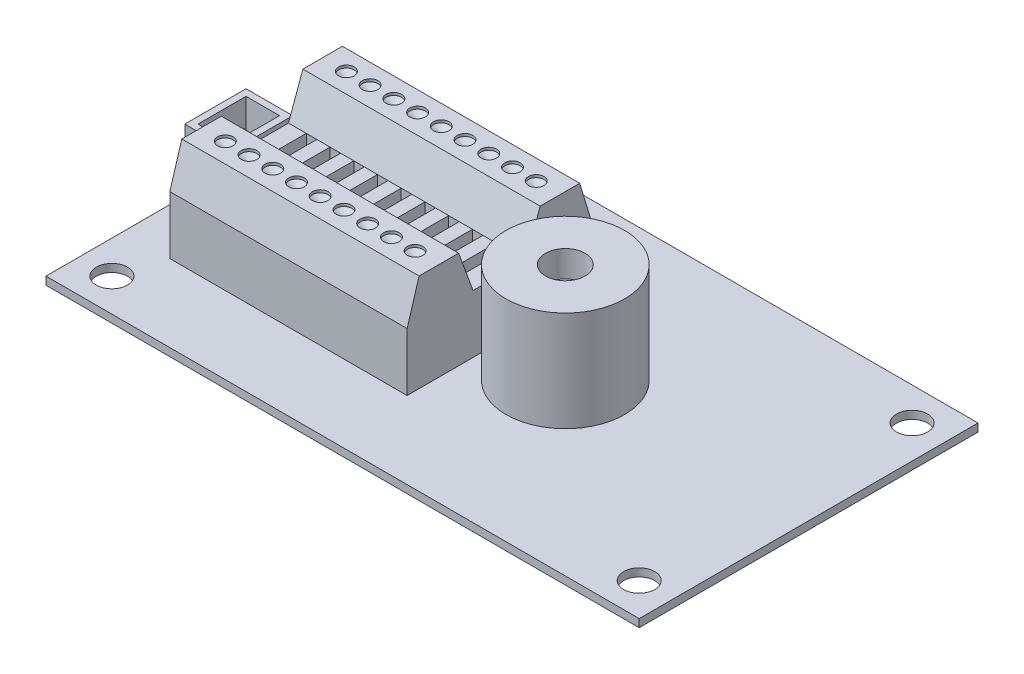
from build123d import *

# Parameters (mm, degrees)
SKETCH1_W                      = 57.15
SKETCH1_H                      = 32.639
BOSS_EXTRUDE1_DEPTH            = 0.762
F_3_0MM_DOWEL_HOLE1_D          = 3
SKETCH5_W                      = 4.5
SKETCH5_H                      = 5.9
BOSS_EXTRUDE2_DEPTH            = 6
SKETCH6_W                      = 3.23
SKETCH6_H                      = 4.63
CUT_EXTRUDE1_DEPTH             = 5.08
SKETCH7_R                      = 0.25
BOSS_EXTRUDE3_DEPTH            = 3.4
BOSS_EXTRUDE4_DEPTH            = 22.86
F_1_5MM_DOWEL_HOLE1_AT_2_COUNT = 2
F_1_5MM_DOWEL_HOLE1_AT_2_PITCH = 2.286
F_1_5MM_DOWEL_HOLE1_AT_3_COUNT = 2
F_1_5MM_DOWEL_HOLE1_AT_3_PITCH = 4.572
F_1_5MM_DOWEL_HOLE1_AT_4_COUNT = 2
F_1_5MM_DOWEL_HOLE1_AT_4_PITCH = 6.858
F_1_5MM_DOWEL_HOLE1_AT_5_COUNT = 2
F_1_5MM_DOWEL_HOLE1_AT_5_PITCH = 9.144
F_1_5MM_DOWEL_HOLE1_AT_6_COUNT = 2
F_1_5MM_DOWEL_HOLE1_AT_6_PITCH = 11.43
F_1_5MM_DOWEL_HOLE1_AT_7_COUNT = 2
F_1_5MM_DOWEL_HOLE1_AT_7_PITCH = 13.716
F_1_5MM_DOWEL_HOLE1_AT_8_COUNT = 2
F_1_5MM_DOWEL_HOLE1_AT_8_PITCH = 16.002
F_1_5MM_DOWEL_HOLE1_AT_9_COUNT = 2
F_1_5MM_DOWEL_HOLE1_AT_9_PITCH = 18.288
SKETCH13_W                     = 1.016
SKETCH13_H                     = 2.54
CUT_EXTRUDE2_DEPTH             = 1.27
LPATTERN1_COUNT                = 9
LPATTERN1_PITCH                = 2.286
MIRROR1_COPY_9_SKETCH_W        = 1.016
MIRROR1_COPY_9_SKETCH_H        = 2.54
MIRROR1_COPY_9_DEPTH           = 1.27
MIRROR1_COPY_10_SKETCH_W       = 1.016
MIRROR1_COPY_10_SKETCH_H       = 2.54
MIRROR1_COPY_10_DEPTH          = 1.27
MIRROR1_COPY_11_SKETCH_W       = 1.016
MIRROR1_COPY_11_SKETCH_H       = 2.54
MIRROR1_COPY_11_DEPTH          = 1.27
MIRROR1_COPY_12_SKETCH_W       = 1.016
MIRROR1_COPY_12_SKETCH_H       = 2.54
MIRROR1_COPY_12_DEPTH          = 1.27
MIRROR1_COPY_13_SKETCH_W       = 1.016
MIRROR1_COPY_13_SKETCH_H       = 2.54
MIRROR1_COPY_13_DEPTH          = 1.27
MIRROR1_COPY_14_SKETCH_W       = 1.016
MIRROR1_COPY_14_SKETCH_H       = 2.54
MIRROR1_COPY_14_DEPTH          = 1.27
MIRROR1_COPY_15_SKETCH_W       = 1.016
MIRROR1_COPY_15_SKETCH_H       = 2.54
MIRROR1_COPY_15_DEPTH          = 1.27
MIRROR1_COPY_16_SKETCH_W       = 1.016
MIRROR1_COPY_16_SKETCH_H       = 2.54
MIRROR1_COPY_16_DEPTH          = 1.27
SKETCH15_R                     = 5.715
BOSS_EXTRUDE5_DEPTH            = 9.652
SKETCH16_R                     = 1.905
CUT_EXTRUDE3_DEPTH             = 2.54


with BuildPart() as part:
    # Sketch1 → Boss-Extrude1 (new body)
    with BuildSketch(Plane(origin=(0, 0, 0), x_dir=(1, 0, 0), z_dir=(0, 1, 0))):
        Rectangle(SKETCH1_W, SKETCH1_H)
    extrude(amount=BOSS_EXTRUDE1_DEPTH)

    # Ø3.0mm Dowel Hole1 (through all)
    with Locations(Plane(origin=(0, 0.762, 0), x_dir=(1, 0, 0), z_dir=(0, 1, 0))):
        with Locations((-25.4, 13.1445), (-25.4, -13.1445), (25.4, -13.1445), (25.4, 13.1445)):
            Hole(F_3_0MM_DOWEL_HOLE1_D / 2)

    # Sketch5 → Boss-Extrude2 (add)
    with BuildSketch(Plane(origin=(0, 0.762, 0), x_dir=(1, 0, 0), z_dir=(0, 1, 0))):
        with Locations((-26.325, 0)):
            Rectangle(SKETCH5_W, SKETCH5_H)
    extrude(amount=BOSS_EXTRUDE2_DEPTH)

    # Sketch6 → Cut-Extrude1 (cut)
    with BuildSketch(Plane(origin=(0, 6.762, 0), x_dir=(1, 0, 0), z_dir=(0, 1, 0))):
        with Locations((-26.325, 0)):
            Rectangle(SKETCH6_W, SKETCH6_H)
    extrude(amount=-CUT_EXTRUDE1_DEPTH, mode=Mode.SUBTRACT)

    # Sketch7 → Boss-Extrude3 (add)
    with BuildSketch(Plane(origin=(0, 1.682, 0), x_dir=(1, 0, 0), z_dir=(0, 1, 0))):
        with Locations(Location((-26.875, 1, 0), (0, 0, 270))):
            Circle(SKETCH7_R)
        with Locations(Location((-26.875, -1, 0), (0, 0, 270))):
            Circle(SKETCH7_R)
    extrude(amount=BOSS_EXTRUDE3_DEPTH)

    # Sketch9 → Boss-Extrude4 (add)
    with BuildSketch(Plane(origin=(-24.075, 0, 0), x_dir=(0, 0, -1), z_dir=(1, 0, 0))):
        Polygon((0, 0), (0, 6.35), (2.54, 6.35), (3.926726593, 10.16), (7.736726593, 10.16), (8.89, 6.35), (8.89, 0), align=None)
    boss_extrude4 = extrude(amount=BOSS_EXTRUDE4_DEPTH)

    # Sketch11 → Ø1.5mm Dowel Hole1 (revolve, cut)
    with BuildSketch(Plane(origin=(-21.789, 10.16, -5.831726593), x_dir=(0, 0, 1), z_dir=(1, 0, 0))):
        Polygon((0, 0), (0, 0.704645464), (0.75, 0.254), (0.75, 0), align=None)
    f_1_5mm_dowel_hole1 = revolve(axis=Axis((-21.789, 16.51, -5.831726593), (0, -1, 0)), mode=Mode.SUBTRACT)

    # Ø1.5mm Dowel Hole1 at 2: Ø1.5mm Dowel Hole1 ×2
    with Locations(*[(i * F_1_5MM_DOWEL_HOLE1_AT_2_PITCH, 0, 0) for i in range(1, F_1_5MM_DOWEL_HOLE1_AT_2_COUNT)]):
        add(f_1_5mm_dowel_hole1, mode=Mode.SUBTRACT)

    # Ø1.5mm Dowel Hole1 at 3: Ø1.5mm Dowel Hole1 ×2
    with Locations(*[(i * F_1_5MM_DOWEL_HOLE1_AT_3_PITCH, 0, 0) for i in range(1, F_1_5MM_DOWEL_HOLE1_AT_3_COUNT)]):
        add(f_1_5mm_dowel_hole1, mode=Mode.SUBTRACT)

    # Ø1.5mm Dowel Hole1 at 4: Ø1.5mm Dowel Hole1 ×2
    with Locations(*[(i * F_1_5MM_DOWEL_HOLE1_AT_4_PITCH, 0, 0) for i in range(1, F_1_5MM_DOWEL_HOLE1_AT_4_COUNT)]):
        add(f_1_5mm_dowel_hole1, mode=Mode.SUBTRACT)

    # Ø1.5mm Dowel Hole1 at 5: Ø1.5mm Dowel Hole1 ×2
    with Locations(*[(i * F_1_5MM_DOWEL_HOLE1_AT_5_PITCH, 0, 0) for i in range(1, F_1_5MM_DOWEL_HOLE1_AT_5_COUNT)]):
        add(f_1_5mm_dowel_hole1, mode=Mode.SUBTRACT)

    # Ø1.5mm Dowel Hole1 at 6: Ø1.5mm Dowel Hole1 ×2
    with Locations(*[(i * F_1_5MM_DOWEL_HOLE1_AT_6_PITCH, 0, 0) for i in range(1, F_1_5MM_DOWEL_HOLE1_AT_6_COUNT)]):
        add(f_1_5mm_dowel_hole1, mode=Mode.SUBTRACT)

    # Ø1.5mm Dowel Hole1 at 7: Ø1.5mm Dowel Hole1 ×2
    with Locations(*[(i * F_1_5MM_DOWEL_HOLE1_AT_7_PITCH, 0, 0) for i in range(1, F_1_5MM_DOWEL_HOLE1_AT_7_COUNT)]):
        add(f_1_5mm_dowel_hole1, mode=Mode.SUBTRACT)

    # Ø1.5mm Dowel Hole1 at 8: Ø1.5mm Dowel Hole1 ×2
    with Locations(*[(i * F_1_5MM_DOWEL_HOLE1_AT_8_PITCH, 0, 0) for i in range(1, F_1_5MM_DOWEL_HOLE1_AT_8_COUNT)]):
        add(f_1_5mm_dowel_hole1, mode=Mode.SUBTRACT)

    # Ø1.5mm Dowel Hole1 at 9: Ø1.5mm Dowel Hole1 ×2
    with Locations(*[(i * F_1_5MM_DOWEL_HOLE1_AT_9_PITCH, 0, 0) for i in range(1, F_1_5MM_DOWEL_HOLE1_AT_9_COUNT)]):
        add(f_1_5mm_dowel_hole1, mode=Mode.SUBTRACT)

    # Sketch13 → Cut-Extrude2 (cut)
    with BuildSketch(Plane(origin=(0, 6.35, 0), x_dir=(1, 0, 0), z_dir=(0, 1, 0))):
        with Locations((-21.847835496, 1.27)):
            Rectangle(SKETCH13_W, SKETCH13_H)
    cut_extrude2 = extrude(amount=-CUT_EXTRUDE2_DEPTH, mode=Mode.SUBTRACT)

    # LPattern1: Cut-Extrude2 ×9
    with Locations(*[(i * LPATTERN1_PITCH, 0, 0) for i in range(1, LPATTERN1_COUNT)]):
        add(cut_extrude2, mode=Mode.SUBTRACT)

    # Mirror1: Boss-Extrude4, Ø1.5mm Dowel Hole1, Cut-Extrude2 across plane
    add(boss_extrude4.mirror(Plane.XY))
    add(f_1_5mm_dowel_hole1.mirror(Plane.XY), mode=Mode.SUBTRACT)
    add(cut_extrude2.mirror(Plane.XY), mode=Mode.SUBTRACT)

    # Mirror1 copy 1 sketch → Mirror1 copy 1 (revolve, cut)
    with BuildSketch(Plane(origin=(-19.503, 10.16, 5.831726593), x_dir=(0, 0, -1), z_dir=(1, 0, 0))):
        Polygon((0, 0), (0, -0.704645464), (0.75, -0.254), (0.75, 0), align=None)
    revolve(axis=Axis((-19.503, 16.51, 5.831726593), (0, 1, 0)), mode=Mode.SUBTRACT)

    # Mirror1 copy 2 sketch → Mirror1 copy 2 (revolve, cut)
    with BuildSketch(Plane(origin=(-17.217, 10.16, 5.831726593), x_dir=(0, 0, -1), z_dir=(1, 0, 0))):
        Polygon((0, 0), (0, -0.704645464), (0.75, -0.254), (0.75, 0), align=None)
    revolve(axis=Axis((-17.217, 16.51, 5.831726593), (0, 1, 0)), mode=Mode.SUBTRACT)

    # Mirror1 copy 3 sketch → Mirror1 copy 3 (revolve, cut)
    with BuildSketch(Plane(origin=(-14.931, 10.16, 5.831726593), x_dir=(0, 0, -1), z_dir=(1, 0, 0))):
        Polygon((0, 0), (0, -0.704645464), (0.75, -0.254), (0.75, 0), align=None)
    revolve(axis=Axis((-14.931, 16.51, 5.831726593), (0, 1, 0)), mode=Mode.SUBTRACT)

    # Mirror1 copy 4 sketch → Mirror1 copy 4 (revolve, cut)
    with BuildSketch(Plane(origin=(-12.645, 10.16, 5.831726593), x_dir=(0, 0, -1), z_dir=(1, 0, 0))):
        Polygon((0, 0), (0, -0.704645464), (0.75, -0.254), (0.75, 0), align=None)
    revolve(axis=Axis((-12.645, 16.51, 5.831726593), (0, 1, 0)), mode=Mode.SUBTRACT)

    # Mirror1 copy 5 sketch → Mirror1 copy 5 (revolve, cut)
    with BuildSketch(Plane(origin=(-10.359, 10.16, 5.831726593), x_dir=(0, 0, -1), z_dir=(1, 0, 0))):
        Polygon((0, 0), (0, -0.704645464), (0.75, -0.254), (0.75, 0), align=None)
    revolve(axis=Axis((-10.359, 16.51, 5.831726593), (0, 1, 0)), mode=Mode.SUBTRACT)

    # Mirror1 copy 6 sketch → Mirror1 copy 6 (revolve, cut)
    with BuildSketch(Plane(origin=(-8.073, 10.16, 5.831726593), x_dir=(0, 0, -1), z_dir=(1, 0, 0))):
        Polygon((0, 0), (0, -0.704645464), (0.75, -0.254), (0.75, 0), align=None)
    revolve(axis=Axis((-8.073, 16.51, 5.831726593), (0, 1, 0)), mode=Mode.SUBTRACT)

    # Mirror1 copy 7 sketch → Mirror1 copy 7 (revolve, cut)
    with BuildSketch(Plane(origin=(-5.787, 10.16, 5.831726593), x_dir=(0, 0, -1), z_dir=(1, 0, 0))):
        Polygon((0, 0), (0, -0.704645464), (0.75, -0.254), (0.75, 0), align=None)
    revolve(axis=Axis((-5.787, 16.51, 5.831726593), (0, 1, 0)), mode=Mode.SUBTRACT)

    # Mirror1 copy 8 sketch → Mirror1 copy 8 (revolve, cut)
    with BuildSketch(Plane(origin=(-3.501, 10.16, 5.831726593), x_dir=(0, 0, -1), z_dir=(1, 0, 0))):
        Polygon((0, 0), (0, -0.704645464), (0.75, -0.254), (0.75, 0), align=None)
    revolve(axis=Axis((-3.501, 16.51, 5.831726593), (0, 1, 0)), mode=Mode.SUBTRACT)

    # Mirror1 copy 9 sketch → Mirror1 copy 9 (cut)
    with BuildSketch(Plane(origin=(2.286, 6.35, 0), x_dir=(1, 0, 0), z_dir=(0, 1, 0))):
        with Locations((-21.847835496, -1.27)):
            Rectangle(MIRROR1_COPY_9_SKETCH_W, MIRROR1_COPY_9_SKETCH_H)
    extrude(amount=-MIRROR1_COPY_9_DEPTH, mode=Mode.SUBTRACT)

    # Mirror1 copy 10 sketch → Mirror1 copy 10 (cut)
    with BuildSketch(Plane(origin=(4.572, 6.35, 0), x_dir=(1, 0, 0), z_dir=(0, 1, 0))):
        with Locations((-21.847835496, -1.27)):
            Rectangle(MIRROR1_COPY_10_SKETCH_W, MIRROR1_COPY_10_SKETCH_H)
    extrude(amount=-MIRROR1_COPY_10_DEPTH, mode=Mode.SUBTRACT)

    # Mirror1 copy 11 sketch → Mirror1 copy 11 (cut)
    with BuildSketch(Plane(origin=(6.858, 6.35, 0), x_dir=(1, 0, 0), z_dir=(0, 1, 0))):
        with Locations((-21.847835496, -1.27)):
            Rectangle(MIRROR1_COPY_11_SKETCH_W, MIRROR1_COPY_11_SKETCH_H)
    extrude(amount=-MIRROR1_COPY_11_DEPTH, mode=Mode.SUBTRACT)

    # Mirror1 copy 12 sketch → Mirror1 copy 12 (cut)
    with BuildSketch(Plane(origin=(9.144, 6.35, 0), x_dir=(1, 0, 0), z_dir=(0, 1, 0))):
        with Locations((-21.847835496, -1.27)):
            Rectangle(MIRROR1_COPY_12_SKETCH_W, MIRROR1_COPY_12_SKETCH_H)
    extrude(amount=-MIRROR1_COPY_12_DEPTH, mode=Mode.SUBTRACT)

    # Mirror1 copy 13 sketch → Mirror1 copy 13 (cut)
    with BuildSketch(Plane(origin=(11.43, 6.35, 0), x_dir=(1, 0, 0), z_dir=(0, 1, 0))):
        with Locations((-21.847835496, -1.27)):
            Rectangle(MIRROR1_COPY_13_SKETCH_W, MIRROR1_COPY_13_SKETCH_H)
    extrude(amount=-MIRROR1_COPY_13_DEPTH, mode=Mode.SUBTRACT)

    # Mirror1 copy 14 sketch → Mirror1 copy 14 (cut)
    with BuildSketch(Plane(origin=(13.716, 6.35, 0), x_dir=(1, 0, 0), z_dir=(0, 1, 0))):
        with Locations((-21.847835496, -1.27)):
            Rectangle(MIRROR1_COPY_14_SKETCH_W, MIRROR1_COPY_14_SKETCH_H)
    extrude(amount=-MIRROR1_COPY_14_DEPTH, mode=Mode.SUBTRACT)

    # Mirror1 copy 15 sketch → Mirror1 copy 15 (cut)
    with BuildSketch(Plane(origin=(16.002, 6.35, 0), x_dir=(1, 0, 0), z_dir=(0, 1, 0))):
        with Locations((-21.847835496, -1.27)):
            Rectangle(MIRROR1_COPY_15_SKETCH_W, MIRROR1_COPY_15_SKETCH_H)
    extrude(amount=-MIRROR1_COPY_15_DEPTH, mode=Mode.SUBTRACT)

    # Mirror1 copy 16 sketch → Mirror1 copy 16 (cut)
    with BuildSketch(Plane(origin=(18.288, 6.35, 0), x_dir=(1, 0, 0), z_dir=(0, 1, 0))):
        with Locations((-21.847835496, -1.27)):
            Rectangle(MIRROR1_COPY_16_SKETCH_W, MIRROR1_COPY_16_SKETCH_H)
    extrude(amount=-MIRROR1_COPY_16_DEPTH, mode=Mode.SUBTRACT)

    # Sketch15 → Boss-Extrude5 (add)
    with BuildSketch(Plane(origin=(0, 0.762, 0), x_dir=(1, 0, 0), z_dir=(0, 1, 0))):
        with Locations(Location((5.135, 0, 0), (0, 0, 270))):
            Circle(SKETCH15_R)
    extrude(amount=BOSS_EXTRUDE5_DEPTH)

    # Sketch16 → Cut-Extrude3 (cut)
    with BuildSketch(Plane(origin=(0, 10.414, 0), x_dir=(1, 0, 0), z_dir=(0, 1, 0))):
        with Locations(Location((5.135, 0, 0), (0, 0, 270))):
            Circle(SKETCH16_R)
    extrude(amount=-CUT_EXTRUDE3_DEPTH, mode=Mode.SUBTRACT)


solid = part.part
